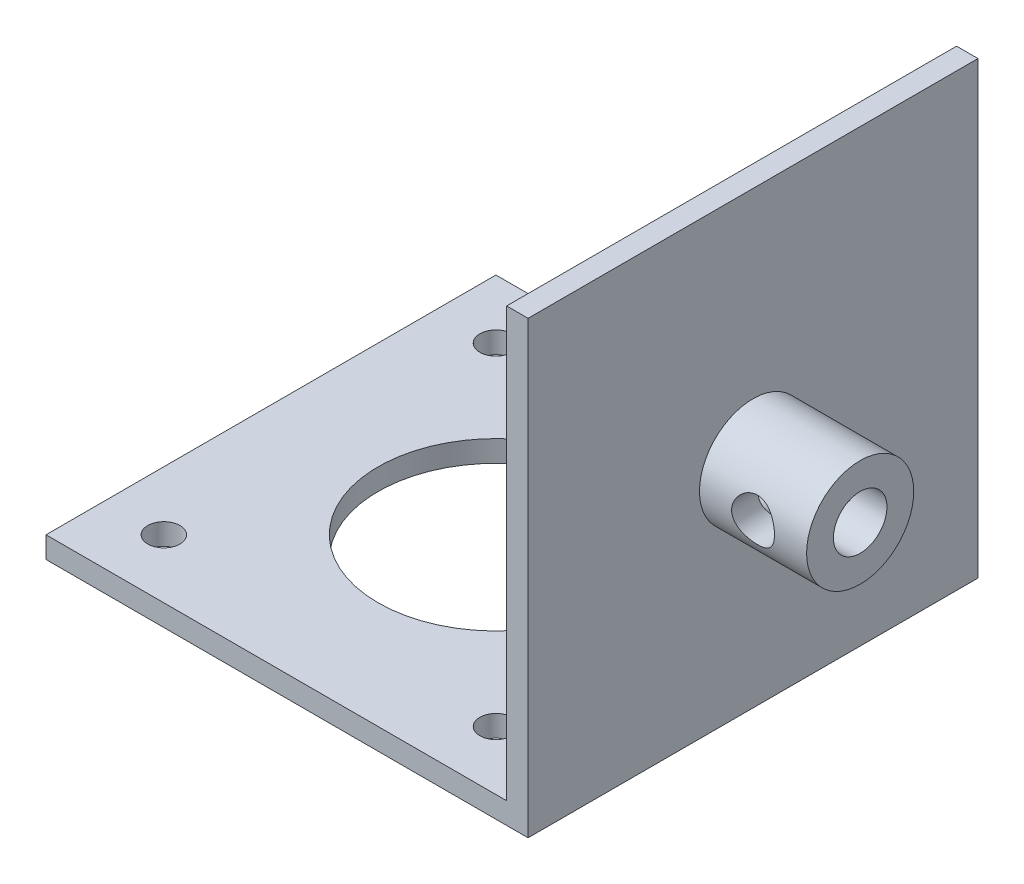
from build123d import *

# Parameters (mm, degrees)
SKETCH_1_W          = 45
SKETCH_1_H          = 42
EXTRUDE_1_DEPTH     = 2
SKETCH_2_R          = 11
SKETCH_2_R_2        = 1.5
CUT_EXTRUDE_1_DEPTH = 2
SKETCH_3_W          = 2
SKETCH_3_H          = 42
EXTRUDE_2_DEPTH     = 40
SKETCH_4_R          = 5
SKETCH_4_R_2        = 2.5
EXTRUDE_3_DEPTH     = 10
SKETCH_5_R          = 2
CUT_EXTRUDE_2_DEPTH = 81.950602221


with BuildPart() as part:
    # 草图1 → 凸台-拉伸1 (new body)
    with BuildSketch(Plane(origin=(0, 0, 0), x_dir=(1, 0, 0), z_dir=(0, 1, 0))):
        with Locations((22.5, 21)):
            Rectangle(SKETCH_1_W, SKETCH_1_H)
    extrude(amount=EXTRUDE_1_DEPTH)

    # 草图2 → 切除-拉伸1 (cut)
    with BuildSketch(Plane(origin=(0, 2, 0), x_dir=(1, 0, 0), z_dir=(0, 1, 0))):
        with Locations(Location((21, 21, 0), (0, 0, 270))):
            Circle(SKETCH_2_R)
        with Locations(Location((5.5, 5.5, 0), (0, 0, 270))):
            Circle(SKETCH_2_R_2)
        with Locations(Location((5.5, 36.5, 0), (0, 0, 270))):
            Circle(SKETCH_2_R_2)
        with Locations(Location((36.5, 36.5, 0), (0, 0, 270))):
            Circle(SKETCH_2_R_2)
        with Locations(Location((36.5, 5.5, 0), (0, 0, 270))):
            Circle(SKETCH_2_R_2)
    extrude(amount=-CUT_EXTRUDE_1_DEPTH, mode=Mode.SUBTRACT)

    # 草图3 → 凸台-拉伸2 (add)
    with BuildSketch(Plane(origin=(0, 2, 0), x_dir=(1, 0, 0), z_dir=(0, 1, 0))):
        with Locations((44, 21)):
            Rectangle(SKETCH_3_W, SKETCH_3_H)
    extrude(amount=EXTRUDE_2_DEPTH)

    # 草图4 → 凸台-拉伸3 (add)
    with BuildSketch(Plane(origin=(45, 0, 0), x_dir=(0, 0, -1), z_dir=(1, 0, 0))):
        with Locations(Location((21, 20, 0), (0, 0, 180))):
            Circle(SKETCH_4_R)
        with Locations((21, 20)):
            Circle(SKETCH_4_R_2, mode=Mode.SUBTRACT)
    extrude(amount=EXTRUDE_3_DEPTH)

    # 草图5 → 切除-拉伸2 (cut, through all)
    with BuildSketch(Plane.XY):
        with Locations((50, 20)):
            Circle(SKETCH_5_R)
    extrude(amount=-CUT_EXTRUDE_2_DEPTH, mode=Mode.SUBTRACT)


solid = part.part
